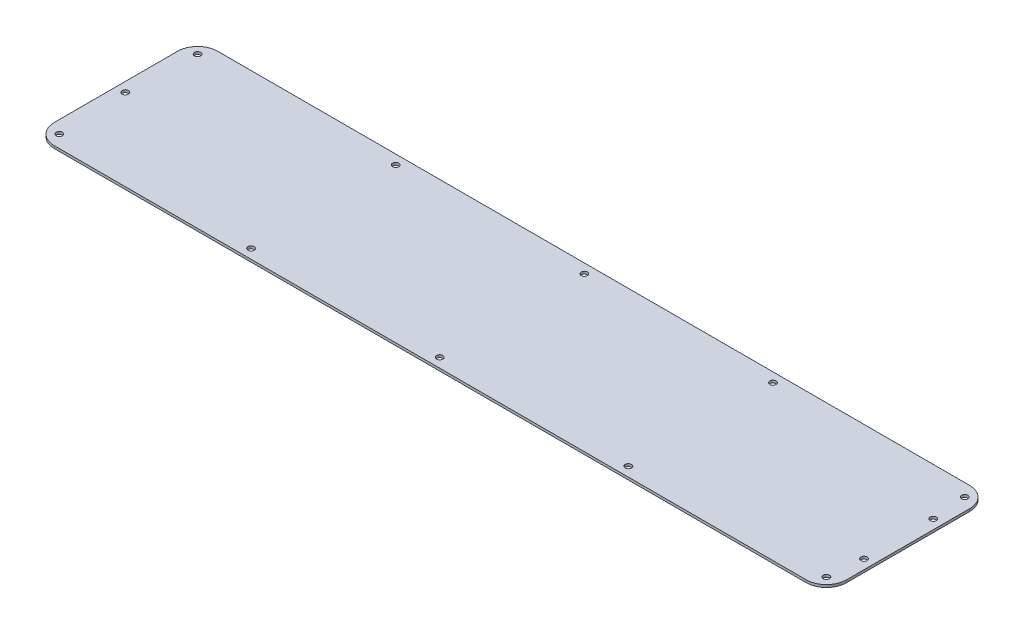
from build123d import *

# Parameters (mm, degrees)
SKETCH1_W                = 630
SKETCH1_H                = 130
BOSS_EXTRUDE1_DEPTH      = 2
FILLET1_R                = 16
F_5_0_5_DIAMETER_HOLE1_D = 5


with BuildPart() as part:
    # Sketch1 → Boss-Extrude1 (new body)
    with BuildSketch(Plane(origin=(0, 0, 0), x_dir=(1, 0, 0), z_dir=(0, 1, 0))):
        Rectangle(SKETCH1_W, SKETCH1_H)
    extrude(amount=BOSS_EXTRUDE1_DEPTH)

    # Fillet1
    fillet1_edges = [part.edges().sort_by_distance(p)[0] for p in [
        (315, 1, 65),
        (-315, 1, 65),
        (-315, 1, -65),
        (315, 1, -65),
    ]]
    fillet(fillet1_edges, radius=FILLET1_R)

    # Ø5.0 (5) Diameter Hole1 (through all)
    with Locations(Plane(origin=(-305.01040764, 2, -55.01040764), x_dir=(0, 0, 1), z_dir=(0, 1, 0))):
        with Locations((0, 0), (-2.48959236, 155.01040764), (55.01040764, -2.48959236), (110.02081528, 0), (112.51040764, 155.01040764), (-2.48959236, 305.01040764), (112.51040764, 305.01040764), (112.51040764, 455.01040764), (-2.48959236, 455.01040764), (0, 610.02081528), (110.02081528, 610.02081528), (27.51040764, 612.51040764), (82.51040764, 612.51040764)):
            Hole(F_5_0_5_DIAMETER_HOLE1_D / 2)


solid = part.part
